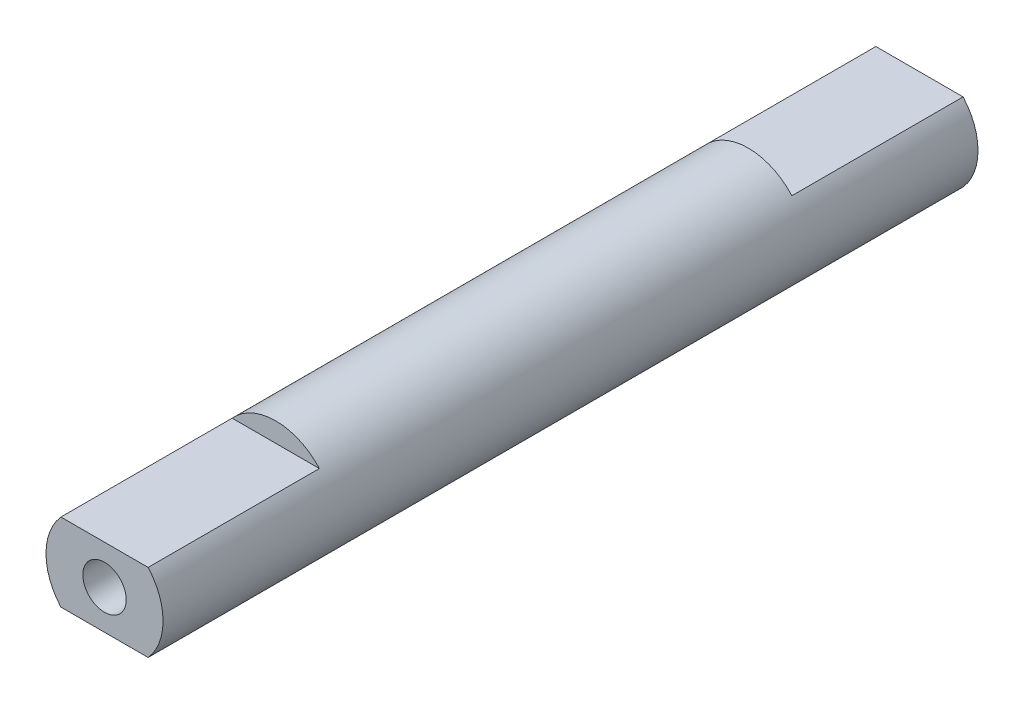
from build123d import *

# Parameters (mm, degrees)
CROQUIS1_R              = 2.7
CROQUIS1_R_2            = 1
SALIENTE_EXTRUIR1_DEPTH = 18.8
CORTAR_EXTRUIR2_START   = -7.9
CORTAR_EXTRUIR2_DEPTH   = 7.9


with BuildPart() as part:
    # Croquis1 → Saliente-Extruir1 (new, symmetric)
    with BuildSketch(Plane.XY):
        Circle(CROQUIS1_R)
        Circle(CROQUIS1_R_2, mode=Mode.SUBTRACT)
    extrude(amount=SALIENTE_EXTRUIR1_DEPTH, both=True)

    # Croquis4 → Cortar-Extruir2 (cut)
    with BuildSketch(Plane(origin=(0, 0, -18.8), x_dir=(-1, 0, 0), z_dir=(0, 0, -1)).offset(CORTAR_EXTRUIR2_START)):
        with BuildLine():
            Line((-2.01246118, 1.8), (2.01246118, 1.8))
            ThreePointArc((2.01246118, 1.8), (0, 2.7), (-2.01246118, 1.8))
        make_face()
        with BuildLine():
            Line((-2.01246118, -1.8), (2.01246118, -1.8))
            ThreePointArc((2.01246118, -1.8), (0, -2.7), (-2.01246118, -1.8))
        make_face()
    cortar_extruir2 = extrude(amount=CORTAR_EXTRUIR2_DEPTH, mode=Mode.SUBTRACT)

    # Simetría1: Cortar-Extruir2 across plane
    add(cortar_extruir2.mirror(Plane.XY), mode=Mode.SUBTRACT)


solid = part.part
